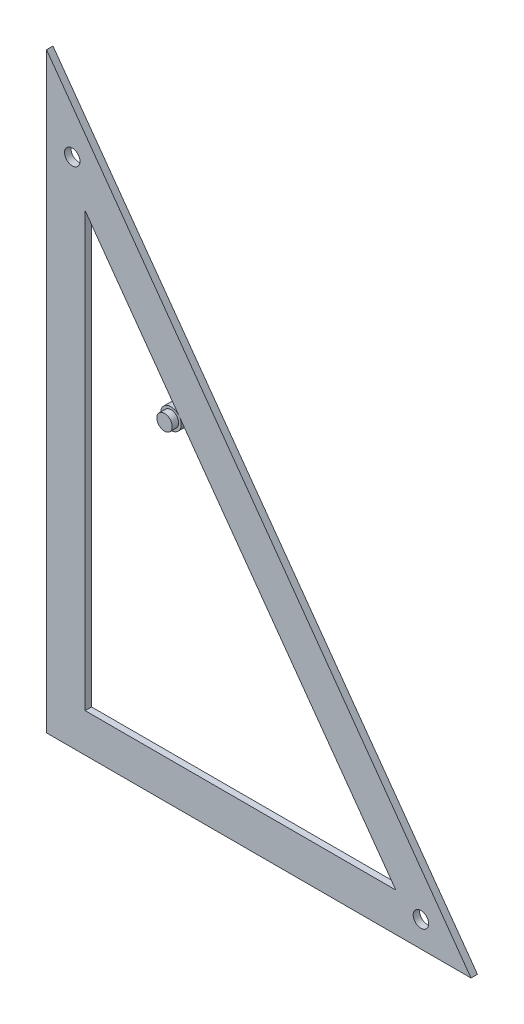
from build123d import *

# Parameters (mm, degrees)
SKETCH_1_R      = 6
EXTRUDE_1_DEPTH = 2.5
SKETCH_2_R      = 8
EXTRUDE_2_DEPTH = 2.5
SKETCH_3_R      = 6
EXTRUDE_3_DEPTH = 7.5


with BuildPart() as part:
    # 草图1 → 凸台-拉伸1 (new, symmetric)
    with BuildSketch(Plane.XY):
        Polygon((0, 0), (0, 460), (330, 0), align=None)
        with Locations((20, 397.810473079)):
            Circle(SKETCH_1_R, mode=Mode.SUBTRACT)
        with Locations((291.037948079, 20)):
            Circle(SKETCH_1_R, mode=Mode.SUBTRACT)
        Polygon((30, 30), (30, 366.715709619), (271.556922118, 30), align=None, mode=Mode.SUBTRACT)
    extrude(amount=EXTRUDE_1_DEPTH, both=True)


with BuildPart() as body_2:
    # 草图2 → 凸台-拉伸2 (new, symmetric)
    with BuildSketch(Plane.XY):
        with Locations((96.711231784, 260)):
            Circle(SKETCH_2_R)
    extrude(amount=EXTRUDE_2_DEPTH, both=True)

    # 草图3 → 凸台-拉伸3 (add, symmetric)
    with BuildSketch(Plane.XY):
        with Locations((96.711231784, 260)):
            Circle(SKETCH_3_R)
    extrude(amount=EXTRUDE_3_DEPTH, both=True)


solid = Compound([part.part, body_2.part])
